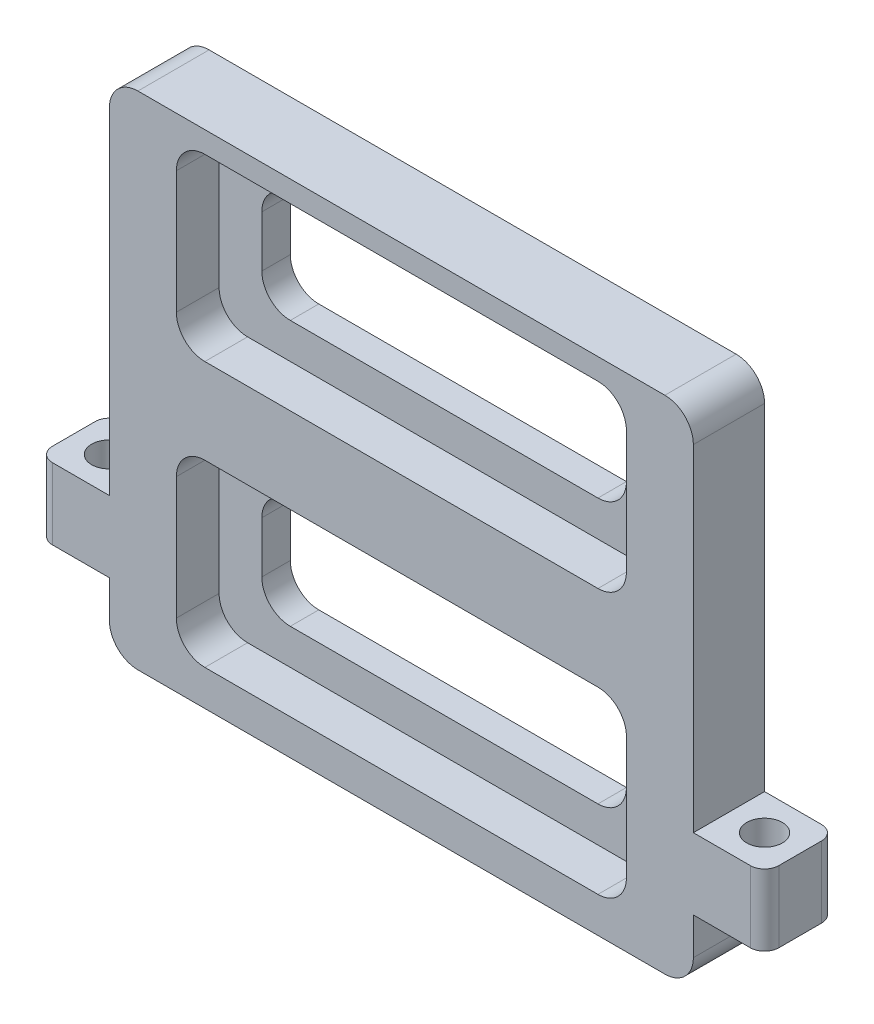
from build123d import *

# Parameters (mm, degrees)
SKETCH1_W                 = 42
SKETCH1_H                 = 43
BOSS_EXTRUDE1_DEPTH       = 5
SKETCH2_W                 = 31.6
SKETCH2_H                 = 12.6
CUT_EXTRUDE1_DEPTH        = 3
SKETCH3_W                 = 25.6
SKETCH3_H                 = 7.6
CUT_EXTRUDE2_DEPTH        = 3
CUT_EXTRUDE3_DEPTH        = 5
SKETCH5_W                 = 5
SKETCH5_H                 = 5
BOSS_EXTRUDE2_DEPTH       = 5
SKETCH6_W                 = 5
SKETCH6_H                 = 5
BOSS_EXTRUDE3_DEPTH       = 5
FILLET1_R                 = 2
FILLET2_R                 = 1
M3X0_5_TAPPED_HOLE1_D     = 2.5
M3X0_5_TAPPED_HOLE1_DEPTH = 7.5
M3X0_5_TAPPED_HOLE1_TIP   = 0.751075774


with BuildPart() as part:
    # Sketch1 → Boss-Extrude1 (new body)
    with BuildSketch(Plane.XY):
        Rectangle(SKETCH1_W, SKETCH1_H)
    extrude(amount=BOSS_EXTRUDE1_DEPTH)

    # Sketch2 → Cut-Extrude1 (cut)
    with BuildSketch(Plane.XY.offset(5)):
        with Locations((-0.5, 10)):
            Rectangle(SKETCH2_W, SKETCH2_H)
        with Locations((-0.5, -8.6)):
            Rectangle(SKETCH2_W, SKETCH2_H)
    extrude(amount=-CUT_EXTRUDE1_DEPTH, mode=Mode.SUBTRACT)

    # Sketch3 → Cut-Extrude2 (cut)
    with BuildSketch(Plane.XY.offset(2)):
        with Locations((-0.5, 10)):
            Rectangle(SKETCH3_W, SKETCH3_H)
        with Locations((-0.5, -8.6)):
            Rectangle(SKETCH3_W, SKETCH3_H)
    extrude(amount=-CUT_EXTRUDE2_DEPTH, mode=Mode.SUBTRACT)

    # Sketch4 → Cut-Extrude3 (cut)
    with BuildSketch(Plane(origin=(0, 0, 0), x_dir=(-1, 0, 0), z_dir=(0, 0, -1))):
        Polygon((-15.288574128, 21.5), (-21, 21.5), (-21, 16.307906388), (-21, -16.83473783), (-21, -21.5), (-15.288574128, -21.5), (16.313805872, -21.5), (21, -21.5), (21, -17.4), (-20, -17.4), (-20, 17.8), (21, 17.8), (21, 21.5), (16.313805872, 21.5), align=None)
    extrude(amount=-CUT_EXTRUDE3_DEPTH, mode=Mode.SUBTRACT)

    # Sketch5 → Boss-Extrude2 (add)
    with BuildSketch(Plane(origin=(20, 0, 0), x_dir=(0, 0, -1), z_dir=(1, 0, 0))):
        with Locations((-2.5, -10.3)):
            Rectangle(SKETCH5_W, SKETCH5_H)
    extrude(amount=BOSS_EXTRUDE2_DEPTH)

    # Sketch6 → Boss-Extrude3 (add)
    with BuildSketch(Plane.ZY.offset(21)):
        with Locations((2.5, -10.3)):
            Rectangle(SKETCH6_W, SKETCH6_H)
    extrude(amount=BOSS_EXTRUDE3_DEPTH)

    # Fillet1
    fillet1_edges = [part.edges().sort_by_distance(p)[0] for p in [
        (-16.3, 3.7, 3.5),
        (-16.3, 16.3, 3.5),
        (15.3, 16.3, 3.5),
        (15.3, 3.7, 3.5),
        (-16.3, -14.9, 3.5),
        (-16.3, -2.3, 3.5),
        (15.3, -2.3, 3.5),
        (15.3, -14.9, 3.5),
        (-13.3, 6.2, 1),
        (-13.3, 13.8, 1),
        (12.3, 13.8, 1),
        (12.3, 6.2, 1),
        (-13.3, -12.4, 1),
        (-13.3, -4.8, 1),
        (12.3, -4.8, 1),
        (12.3, -12.4, 1),
        (20, 17.8, 2.5),
        (20, -17.4, 2.5),
        (-21, -17.4, 2.5),
        (-21, 17.8, 2.5),
    ]]
    fillet(fillet1_edges, radius=FILLET1_R)

    # Fillet2
    fillet2_edges = [part.edges().sort_by_distance(p)[0] for p in [
        (25, -10.3, 0),
        (25, -10.3, 5),
        (-26, -10.3, 0),
        (-26, -10.3, 5),
    ]]
    fillet(fillet2_edges, radius=FILLET2_R)

    # M3x0.5 Tapped Hole1
    with Locations(Plane(origin=(-23.5, -12.8, 2.5), x_dir=(-1, 0, 0), z_dir=(0, -1, 0))):
        with Locations((0, 0), (-46, 0)):
            Hole(M3X0_5_TAPPED_HOLE1_D / 2, depth=M3X0_5_TAPPED_HOLE1_DEPTH)
            with Locations((0, 0, -(M3X0_5_TAPPED_HOLE1_DEPTH + M3X0_5_TAPPED_HOLE1_TIP / 2))):  # 118° drill point
                Cone(0, M3X0_5_TAPPED_HOLE1_D / 2, M3X0_5_TAPPED_HOLE1_TIP, mode=Mode.SUBTRACT)


solid = part.part
